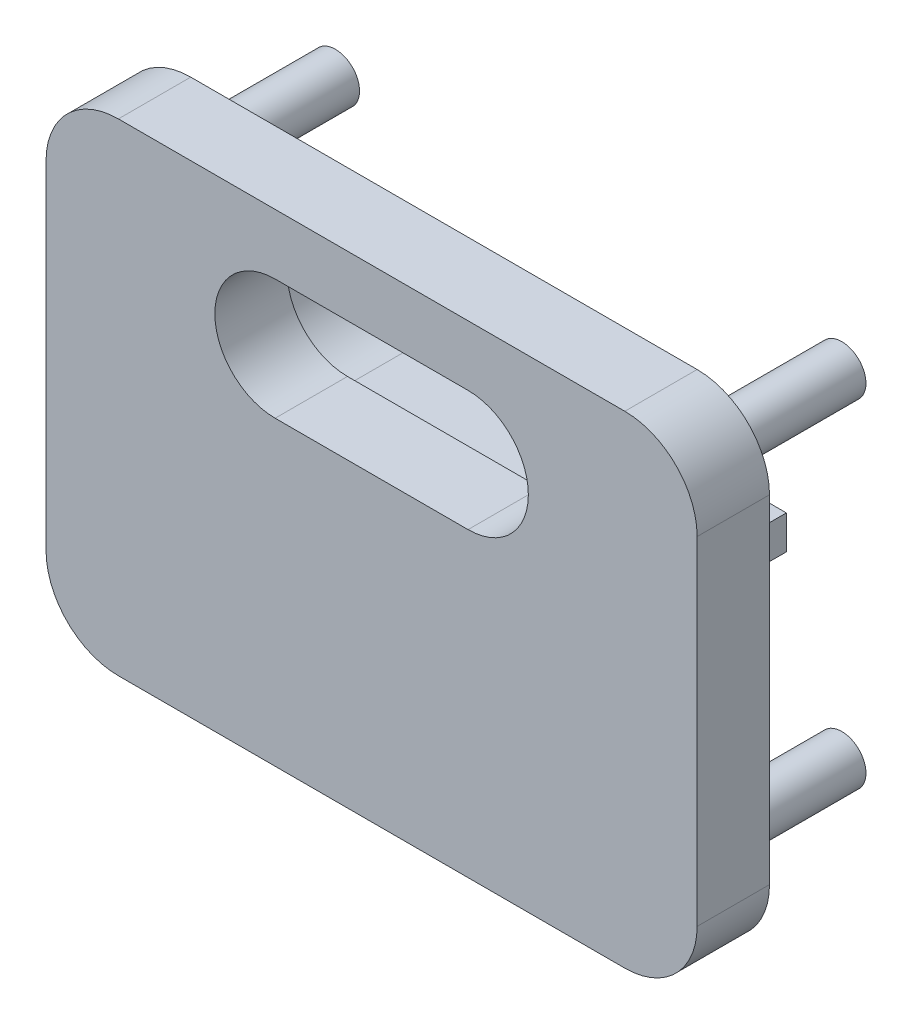
from build123d import *

# Parameters (mm, degrees)
SKETCH1_W           = 27
SKETCH1_H           = 20
BOSS_EXTRUDE1_DEPTH = 50
SKETCH2_W           = 19
SKETCH2_H           = 14
BOSS_EXTRUDE2_DEPTH = 2
SKETCH3_W           = 23
SKETCH3_H           = 2
CUT_EXTRUDE1_DEPTH  = 48
SKETCH4_W           = 0.5
SKETCH4_H           = 9
SKETCH4_W_2         = 19
SKETCH4_H_2         = 0.5
BOSS_EXTRUDE3_DEPTH = 48
FILLET1_R           = 3
CUT_EXTRUDE6_REACH  = 62.241
SKETCH7_W           = 47
SKETCH7_H           = 20
BOSS_EXTRUDE5_DEPTH = 6
CUT_EXTRUDE7_REACH  = 36.132
SKETCH9_R           = 1
BOSS_EXTRUDE6_DEPTH = 6
CUT_EXTRUDE8_DEPTH  = 3


with BuildPart() as part:
    # Sketch1 → Boss-Extrude1 (new body)
    with BuildSketch(Plane.XY):
        with Locations((13.5, 10)):
            Rectangle(SKETCH1_W, SKETCH1_H)
        Polygon((4, 17), (23, 17), (23, 16), (23, 4), (23, 3), (4, 3), (4, 4), (4, 16), align=None, mode=Mode.SUBTRACT)
    extrude(amount=-BOSS_EXTRUDE1_DEPTH)

    # Sketch2 → Boss-Extrude2 (add)
    with BuildSketch(Plane(origin=(0, 0, -50), x_dir=(-1, 0, 0), z_dir=(0, 0, -1))):
        with Locations((-13.5, 10)):
            Rectangle(SKETCH2_W, SKETCH2_H)
    extrude(amount=-BOSS_EXTRUDE2_DEPTH)

    # Sketch3 → Cut-Extrude1 (cut)
    with BuildSketch(Plane.XY):
        with Locations((13.5, 13)):
            Rectangle(SKETCH3_W, SKETCH3_H)
    extrude(amount=-CUT_EXTRUDE1_DEPTH, mode=Mode.SUBTRACT)

    # Sketch4 → Boss-Extrude3 (add)
    with BuildSketch(Plane.XY):
        with Locations((4.25, 7.5)):
            Rectangle(SKETCH4_W, SKETCH4_H)
        with Locations((22.75, 7.5)):
            Rectangle(SKETCH4_W, SKETCH4_H)
        with Locations((13.5, 16.75)):
            Rectangle(SKETCH4_W_2, SKETCH4_H_2)
    extrude(amount=-BOSS_EXTRUDE3_DEPTH)

    # Fillet1
    fillet1_edges = [part.edges().sort_by_distance(p)[0] for p in [
        (0, 0, -25),
        (0, 20, -25),
        (27, 20, -25),
        (27, 0, -25),
    ]]
    fillet(fillet1_edges, radius=FILLET1_R)

    # Sketch7 → Cut-Extrude6 (cut, up to next)
    with BuildSketch(Plane(origin=(27, 0, 0), x_dir=(0, 0, -1), z_dir=(1, 0, 0)), mode=Mode.PRIVATE) as cut_extrude6_sk1:
        with Locations((26.5, 10)):
            Rectangle(SKETCH7_W, SKETCH7_H)
    cut_extrude6_tool1 = extrude(cut_extrude6_sk1.sketch, amount=-CUT_EXTRUDE6_REACH, mode=Mode.PRIVATE) & part.part
    add(cut_extrude6_tool1.solids().sort_by_distance((27, 10, -26.5))[0], mode=Mode.SUBTRACT)

    # Sketch5 → Boss-Extrude5 (add)
    with BuildSketch(Plane.XY):
        Polygon((22.5, 3), (4.5, 3), (4.5, 12), (2, 12), (2, 14), (4, 14), (4, 16.5), (23, 16.5), (23, 14), (25, 14), (25, 12), (22.5, 12), align=None)
    extrude(amount=-BOSS_EXTRUDE5_DEPTH)

    # Sketch8 → Cut-Extrude7 (cut, up to next)
    with BuildSketch(Plane(origin=(0, 0, -6), x_dir=(-1, 0, 0), z_dir=(0, 0, -1)), mode=Mode.PRIVATE) as cut_extrude7_sk1:
        with BuildLine():
            Line((-17.5, 17.5), (-9.5, 17.5))
            ThreePointArc((-9.5, 17.5), (-7, 15), (-9.5, 12.5))
            Line((-9.5, 12.5), (-17.5, 12.5))
            ThreePointArc((-17.5, 12.5), (-20, 15), (-17.5, 17.5))
        make_face()
    cut_extrude7_tool1 = extrude(cut_extrude7_sk1.sketch, amount=-CUT_EXTRUDE7_REACH, mode=Mode.PRIVATE) & part.part
    add(cut_extrude7_tool1.solids().sort_by_distance((13.5, 15, -6))[0], mode=Mode.SUBTRACT)

    # Sketch9 → Boss-Extrude6 (add)
    with BuildSketch(Plane(origin=(0, 0, -3), x_dir=(-1, 0, 0), z_dir=(0, 0, -1))):
        with Locations(Location((-24, 17, 0), (0, 0, 270))):
            Circle(SKETCH9_R)
        with Locations(Location((-3, 17, 0), (0, 0, 270))):
            Circle(SKETCH9_R)
        with Locations(Location((-3, 3, 0), (0, 0, 270))):
            Circle(SKETCH9_R)
        with Locations(Location((-24, 3, 0), (0, 0, 270))):
            Circle(SKETCH9_R)
    extrude(amount=BOSS_EXTRUDE6_DEPTH)

    # Sketch11 → Cut-Extrude8 (cut)
    with BuildSketch(Plane(origin=(0, 0, -6), x_dir=(-1, 0, 0), z_dir=(0, 0, -1))):
        with BuildLine():
            ThreePointArc((-7.5, 16.5), (-7.263932023, 13.881966011), (-9.5, 12.5))
            Line((-9.5, 12.5), (-17.5, 12.5))
            ThreePointArc((-17.5, 12.5), (-19.736067977, 13.881966011), (-19.5, 16.5))
            Line((-19.5, 16.5), (-23, 16.5))
            Line((-23, 16.5), (-23, 14))
            Line((-23, 14), (-25, 14))
            Line((-25, 14), (-25, 12))
            Line((-25, 12), (-22.5, 12))
            Line((-22.5, 12), (-22.5, 3))
            Line((-22.5, 3), (-4.5, 3))
            Line((-4.5, 3), (-4.5, 12))
            Line((-4.5, 12), (-2, 12))
            Line((-2, 12), (-2, 14))
            Line((-2, 14), (-4, 14))
            Line((-4, 14), (-4, 16.5))
            Line((-4, 16.5), (-7.5, 16.5))
        make_face()
        with BuildLine():
            Line((-20.029822128, 16.2), (-22.7, 16.2))
            Line((-22.7, 16.2), (-22.7, 13.7))
            Line((-22.7, 13.7), (-24.7, 13.7))
            Line((-24.7, 13.7), (-24.7, 12.3))
            Line((-24.7, 12.3), (-22.2, 12.3))
            Line((-22.2, 12.3), (-22.2, 3.3))
            Line((-22.2, 3.3), (-4.8, 3.3))
            Line((-4.8, 3.3), (-4.8, 12.3))
            Line((-4.8, 12.3), (-2.3, 12.3))
            Line((-2.3, 12.3), (-2.3, 13.7))
            Line((-2.3, 13.7), (-4.3, 13.7))
            Line((-4.3, 13.7), (-4.3, 16.2))
            Line((-4.3, 16.2), (-6.970177872, 16.2))
            ThreePointArc((-6.970177872, 16.2), (-7.133568087, 13.503337045), (-9.5, 12.2))
            Line((-9.5, 12.2), (-17.5, 12.2))
            ThreePointArc((-17.5, 12.2), (-19.866431913, 13.503337045), (-20.029822128, 16.2))
        make_face(mode=Mode.SUBTRACT)
    extrude(amount=-CUT_EXTRUDE8_DEPTH, mode=Mode.SUBTRACT)


solid = part.part
